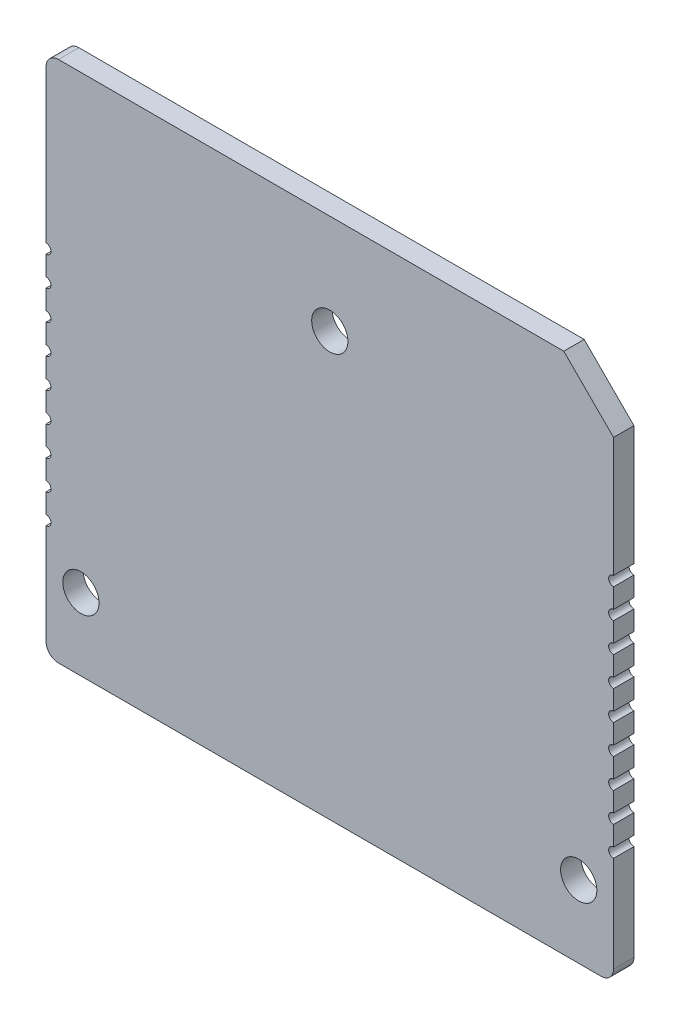
from build123d import *

# Parameters (mm, degrees)
SKETCH1_R           = 0.925
SKETCH1_R_2         = 0.92499942
BOSS_EXTRUDE1_DEPTH = 1.041


with BuildPart() as part:
    # Sketch1 → Boss-Extrude1 (new body)
    with BuildSketch(Plane.XY):
        with BuildLine():
            Line((0, 5.75), (0, 0.635))
            ThreePointArc((0, 0.635), (0.185987194, 0.185987194), (0.635, 0))
            Line((0.635, 0), (28.321, 0))
            ThreePointArc((28.321, 0), (28.770012806, 0.185987194), (28.956, 0.635))
            Line((28.956, 0.635), (28.956, 5.53000114))
            ThreePointArc((28.956, 5.53000114), (28.706, 5.78000114), (28.956, 6.03000114))
            Line((28.956, 6.03000114), (28.956, 7.03000114))
            ThreePointArc((28.956, 7.03000114), (28.706, 7.28000114), (28.956, 7.53000114))
            Line((28.956, 7.53000114), (28.956, 8.53000114))
            ThreePointArc((28.956, 8.53000114), (28.706, 8.78000114), (28.956, 9.03000114))
            Line((28.956, 9.03000114), (28.956, 10.03000114))
            ThreePointArc((28.956, 10.03000114), (28.706, 10.28000114), (28.956, 10.53000114))
            Line((28.956, 10.53000114), (28.956, 11.53000114))
            ThreePointArc((28.956, 11.53000114), (28.706, 11.78000114), (28.956, 12.03000114))
            Line((28.956, 12.03000114), (28.956, 13.03000114))
            ThreePointArc((28.956, 13.03000114), (28.706, 13.28000114), (28.956, 13.53000114))
            Line((28.956, 13.53000114), (28.956, 14.53000114))
            ThreePointArc((28.956, 14.53000114), (28.706, 14.78000114), (28.956, 15.03000114))
            Line((28.956, 15.03000114), (28.956, 16.03000114))
            ThreePointArc((28.956, 16.03000114), (28.706, 16.28000114), (28.956, 16.53000114))
            Line((28.956, 16.53000114), (28.956, 17.53000114))
            ThreePointArc((28.956, 17.53000114), (28.706, 17.78000114), (28.956, 18.03000114))
            Line((28.956, 18.03000114), (28.956, 24.13))
            Line((28.956, 24.13), (26.416, 26.67))
            Line((26.416, 26.67), (0.635, 26.67))
            ThreePointArc((0.635, 26.67), (0.185987194, 26.484012806), (0, 26.035))
            Line((0, 26.035), (0, 18.25))
            ThreePointArc((0, 18.25), (0.25, 18), (0, 17.75))
            Line((0, 17.75), (0, 16.75))
            ThreePointArc((0, 16.75), (0.25, 16.5), (0, 16.25))
            Line((0, 16.25), (0, 15.25))
            ThreePointArc((0, 15.25), (0.25, 15), (0, 14.75))
            Line((0, 14.75), (0, 13.75))
            ThreePointArc((0, 13.75), (0.25, 13.5), (0, 13.25))
            Line((0, 13.25), (0, 12.25))
            ThreePointArc((0, 12.25), (0.25, 12), (0, 11.75))
            Line((0, 11.75), (0, 10.75))
            ThreePointArc((0, 10.75), (0.25, 10.5), (0, 10.25))
            Line((0, 10.25), (0, 9.25))
            ThreePointArc((0, 9.25), (0.25, 9), (0, 8.75))
            Line((0, 8.75), (0, 7.75))
            ThreePointArc((0, 7.75), (0.25, 7.5), (0, 7.25))
            Line((0, 7.25), (0, 6.25))
            ThreePointArc((0, 6.25), (0.25, 6), (0, 5.75))
        make_face()
        with Locations(Location((27.178, 3.683, 0), (0, 0, 180))):
            Circle(SKETCH1_R, mode=Mode.SUBTRACT)
        with Locations(Location((1.778, 3.683, 0), (0, 0, 180))):
            Circle(SKETCH1_R, mode=Mode.SUBTRACT)
        with Locations(Location((14.478, 21.59, 0), (0, 0, 180))):
            Circle(SKETCH1_R_2, mode=Mode.SUBTRACT)
    extrude(amount=-BOSS_EXTRUDE1_DEPTH)


solid = part.part
